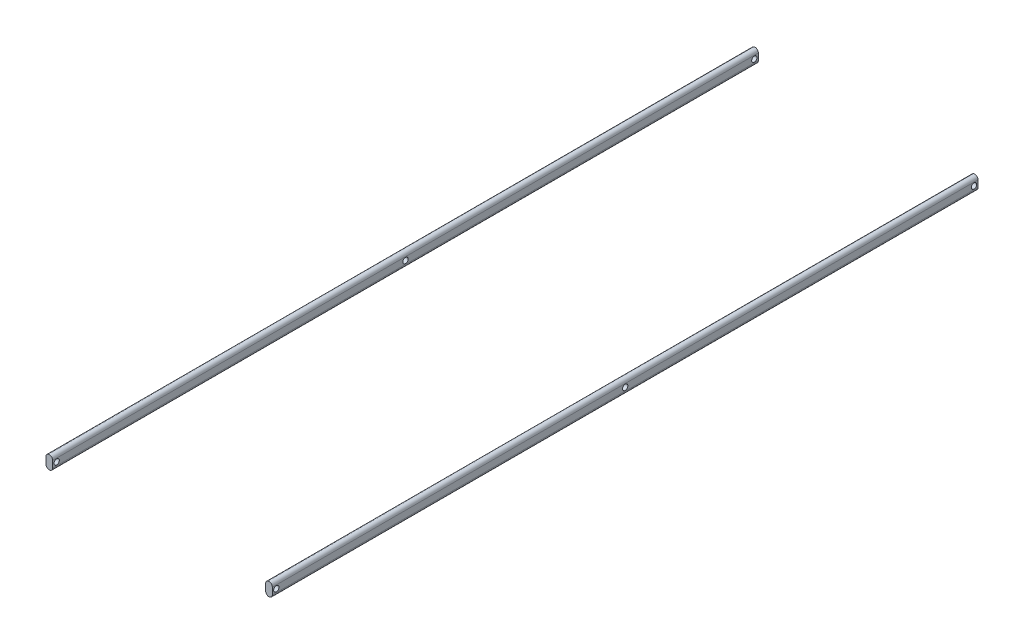
from build123d import *

# Parameters (mm, degrees)
BOSS_EXTRUDE1_DEPTH   = 100
BOSS_EXTRUDE2_DEPTH   = 430
F_4_0MM_DOWEL_HOLE7_D = 4
SKETCH6_W             = 160
SKETCH6_H             = 100
CUT_EXTRUDE1_DEPTH    = 10
FILLET1_RADIUS        = 2.5
FILLET1_LENGTH        = 530
FILLET2_RADIUS        = 2.5
FILLET2_LENGTH        = 530
FILLET4_RADIUS        = 2.5
FILLET4_LENGTH        = 530
FILLET5_RADIUS        = 2.5
FILLET5_LENGTH        = 530


with BuildPart() as part:
    # Sketch1 → Boss-Extrude1 (new body)
    with BuildSketch(Plane.XY):
        Polygon((-75.245901639, 15.204918033), (-75.245901639, 5.204918033), (94.754098361, 5.204918033), (94.754098361, 15.204918033), (89.754098361, 15.204918033), (89.754098361, 10.204918033), (-70.245901639, 10.204918033), (-70.245901639, 15.204918033), align=None)
    extrude(amount=BOSS_EXTRUDE1_DEPTH)

    # Sketch2 → Boss-Extrude2 (add)
    with BuildSketch(Plane.XY.offset(100)):
        Polygon((-75.245901639, 15.204918033), (-75.245901639, 5.204918033), (-70.245901639, 5.204918033), (-70.245901639, 10.204918033), (-70.245901639, 15.204918033), align=None)
        Polygon((89.754098361, 15.204918033), (89.754098361, 10.204918033), (89.754098361, 5.204918033), (94.754098361, 5.204918033), (94.754098361, 15.204918033), align=None)
    extrude(amount=BOSS_EXTRUDE2_DEPTH)

    # Ø4.0mm Dowel Hole7 (through all)
    with Locations(Plane(origin=(94.754098361, 0, 0), x_dir=(0, 0, -1), z_dir=(1, 0, 0))):
        with Locations((-527, 10.204918033), (-265, 10.204918033), (-3, 10.204918033)):
            Hole(F_4_0MM_DOWEL_HOLE7_D / 2)

    # Sketch6 → Cut-Extrude1 (cut)
    with BuildSketch(Plane(origin=(0, 10.204918033, 0), x_dir=(1, 0, 0), z_dir=(0, 1, 0))):
        with Locations((9.754098361, -50)):
            Rectangle(SKETCH6_W, SKETCH6_H)
    extrude(amount=-CUT_EXTRUDE1_DEPTH, mode=Mode.SUBTRACT)


with BuildPart() as cut_extrude1_piece_1:
    # of the separate pieces the step leaves, piece 1, a body of its own (cut_extrude1_pieces)
    add(part.part.solids().sort_by_distance((-75.245901639, 15.204918033, 530))[0])

    # Fillet4: full round fillet: the end face becomes a half cylinder, R = half its width
    fillet4_face = Plane((-72.745901639, 15.204918033, 265), x_dir=(0, 0, -1), z_dir=(0, 1, 0))  # on the end face: x along it, z out of the body
    fillet4_slab = fillet4_face.offset(-FILLET4_RADIUS / 2) * Box(FILLET4_LENGTH, 2 * FILLET4_RADIUS, FILLET4_RADIUS, mode=Mode.PRIVATE)  # the body's end, R deep
    fillet4_round = Plane((-72.745901639, 12.704918033, 265), x_dir=(0, 1, 0), z_dir=(0, 0, -1)) * Cylinder(FILLET4_RADIUS, FILLET4_LENGTH, mode=Mode.PRIVATE)  # its axis R under the face
    add(fillet4_slab - fillet4_round, mode=Mode.SUBTRACT)

    # Fillet5: full round fillet: the end face becomes a half cylinder, R = half its width
    fillet5_face = Plane((-72.745901639, 5.204918033, 265), x_dir=(0, 0, -1), z_dir=(0, -1, 0))  # on the end face: x along it, z out of the body
    fillet5_slab = fillet5_face.offset(-FILLET5_RADIUS / 2) * Box(FILLET5_LENGTH, 2 * FILLET5_RADIUS, FILLET5_RADIUS, mode=Mode.PRIVATE)  # the body's end, R deep
    fillet5_round = Plane((-72.745901639, 7.704918033, 265), x_dir=(0, -1, 0), z_dir=(0, 0, -1)) * Cylinder(FILLET5_RADIUS, FILLET5_LENGTH, mode=Mode.PRIVATE)  # its axis R under the face
    add(fillet5_slab - fillet5_round, mode=Mode.SUBTRACT)


with BuildPart() as cut_extrude1_piece_2:
    # of the separate pieces the step leaves, piece 2, a body of its own (cut_extrude1_pieces)
    add(part.part.solids().sort_by_distance((89.754098361, 5.204918033, 0))[0])

    # Fillet1: full round fillet: the end face becomes a half cylinder, R = half its width
    fillet1_face = Plane((92.254098361, 15.204918033, 265), x_dir=(0, 0, -1), z_dir=(0, 1, 0))  # on the end face: x along it, z out of the body
    fillet1_slab = fillet1_face.offset(-FILLET1_RADIUS / 2) * Box(FILLET1_LENGTH, 2 * FILLET1_RADIUS, FILLET1_RADIUS, mode=Mode.PRIVATE)  # the body's end, R deep
    fillet1_round = Plane((92.254098361, 12.704918033, 265), x_dir=(0, 1, 0), z_dir=(0, 0, -1)) * Cylinder(FILLET1_RADIUS, FILLET1_LENGTH, mode=Mode.PRIVATE)  # its axis R under the face
    add(fillet1_slab - fillet1_round, mode=Mode.SUBTRACT)

    # Fillet2: full round fillet: the end face becomes a half cylinder, R = half its width
    fillet2_face = Plane((92.254098361, 5.204918033, 265), x_dir=(0, 0, 1), z_dir=(0, -1, 0))  # on the end face: x along it, z out of the body
    fillet2_slab = fillet2_face.offset(-FILLET2_RADIUS / 2) * Box(FILLET2_LENGTH, 2 * FILLET2_RADIUS, FILLET2_RADIUS, mode=Mode.PRIVATE)  # the body's end, R deep
    fillet2_round = Plane((92.254098361, 7.704918033, 265), x_dir=(0, -1, 0), z_dir=(0, 0, 1)) * Cylinder(FILLET2_RADIUS, FILLET2_LENGTH, mode=Mode.PRIVATE)  # its axis R under the face
    add(fillet2_slab - fillet2_round, mode=Mode.SUBTRACT)


solid = Compound([cut_extrude1_piece_1.part, cut_extrude1_piece_2.part])
